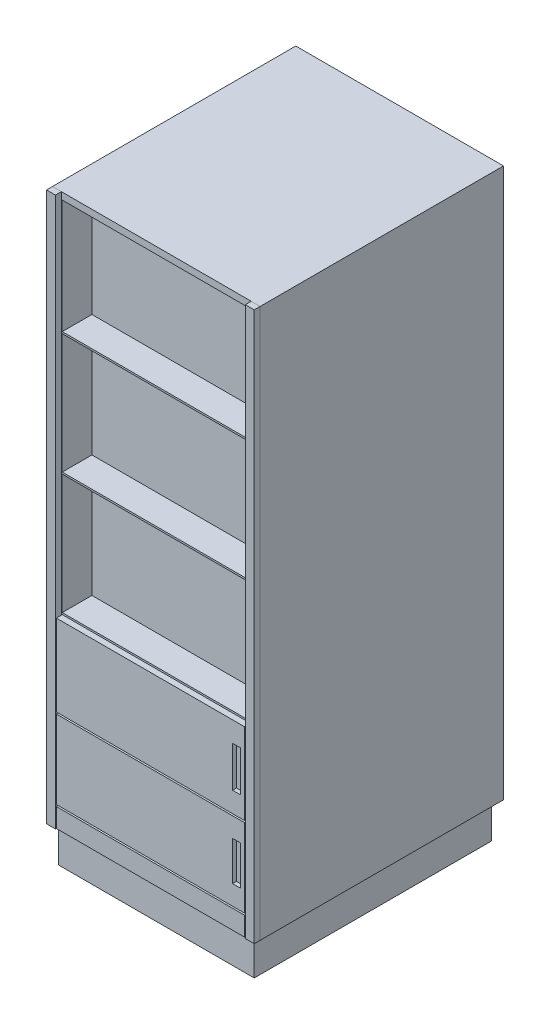
from build123d import *

# Parameters (mm, degrees)
SKETCH1_W              = 700
SKETCH1_H              = 1850
GOVDE_KASA_DEPTH       = 820
SKETCH2_W              = 660
SKETCH2_H              = 120
PLINT_DEPTH            = 800
SKETCH3_W              = 30
SKETCH3_H              = 1850
SOVE_SOL_DEPTH         = 20
SKETCH4_W              = 30
SKETCH4_H              = 1850
SOVE_SAG_DEPTH         = 20
SKETCH5_W              = 634
SKETCH5_H              = 384
ACIKLIK_KAT1_DEPTH     = 100
SKETCH6_W              = 634
SKETCH6_H              = 404
ACIKLIK_KAT2_DEPTH     = 100
SKETCH7_W              = 634
SKETCH7_H              = 404
ACIKLIK_KAT3_DEPTH     = 100
SKETCH8_W              = 634
SKETCH8_H              = 274
KLAPE_ALT_1_DEPTH      = 20
KLAPE_ALT_1_KULP_START = 7
SKETCH9_W              = 26
SKETCH9_H              = 137
KLAPE_ALT_1_KULP_DEPTH = 13
SKETCH10_W             = 634
SKETCH10_H             = 264
KLAPE_ALT_2_DEPTH      = 20
KLAPE_ALT_2_KULP_START = 7
SKETCH11_W             = 26
SKETCH11_H             = 132
KLAPE_ALT_2_KULP_DEPTH = 13
SKETCH12_W             = 634
SKETCH12_H             = 64
PANEL_ALT_DEPTH        = 20


with BuildPart() as part:
    # Sketch1 → govde_kasa (new body)
    with BuildSketch(Plane.XY):
        with Locations((350, 1045)):
            Rectangle(SKETCH1_W, SKETCH1_H)
    extrude(amount=-GOVDE_KASA_DEPTH)

    # Sketch5 → aciklik_kat1 (cut)
    with BuildSketch(Plane.XY):
        with Locations((350, 1755)):
            Rectangle(SKETCH5_W, SKETCH5_H)
    extrude(amount=-ACIKLIK_KAT1_DEPTH, mode=Mode.SUBTRACT)

    # Sketch6 → aciklik_kat2 (cut)
    with BuildSketch(Plane.XY):
        with Locations((350, 1355)):
            Rectangle(SKETCH6_W, SKETCH6_H)
    extrude(amount=-ACIKLIK_KAT2_DEPTH, mode=Mode.SUBTRACT)

    # Sketch7 → aciklik_kat3 (cut)
    with BuildSketch(Plane.XY):
        with Locations((350, 945)):
            Rectangle(SKETCH7_W, SKETCH7_H)
    extrude(amount=-ACIKLIK_KAT3_DEPTH, mode=Mode.SUBTRACT)


with BuildPart() as body_2:
    # Sketch2 → plint (new body)
    with BuildSketch(Plane.XY):
        with Locations((350, 60)):
            Rectangle(SKETCH2_W, SKETCH2_H)
    extrude(amount=-PLINT_DEPTH)


with BuildPart() as body_3:
    # Sketch3 → sove_sol (new body)
    with BuildSketch(Plane.XY):
        with Locations((15, 1045)):
            Rectangle(SKETCH3_W, SKETCH3_H)
    extrude(amount=SOVE_SOL_DEPTH)


with BuildPart() as body_4:
    # Sketch4 → sove_sag (new body)
    with BuildSketch(Plane.XY):
        with Locations((685, 1045)):
            Rectangle(SKETCH4_W, SKETCH4_H)
    extrude(amount=SOVE_SAG_DEPTH)


with BuildPart() as body_5:
    # Sketch8 → klape_alt_1 (new body)
    with BuildSketch(Plane.XY):
        with Locations((350, 600)):
            Rectangle(SKETCH8_W, SKETCH8_H)
    extrude(amount=KLAPE_ALT_1_DEPTH)

    # Sketch9 → klape_alt_1_kulp (cut)
    with BuildSketch(Plane.XY.offset(KLAPE_ALT_1_KULP_START)):
        with Locations((640, 600)):
            Rectangle(SKETCH9_W, SKETCH9_H)
    extrude(amount=KLAPE_ALT_1_KULP_DEPTH, mode=Mode.SUBTRACT)


with BuildPart() as body_6:
    # Sketch10 → klape_alt_2 (new body)
    with BuildSketch(Plane.XY):
        with Locations((350, 325)):
            Rectangle(SKETCH10_W, SKETCH10_H)
    extrude(amount=KLAPE_ALT_2_DEPTH)

    # Sketch11 → klape_alt_2_kulp (cut)
    with BuildSketch(Plane.XY.offset(KLAPE_ALT_2_KULP_START)):
        with Locations((640, 325)):
            Rectangle(SKETCH11_W, SKETCH11_H)
    extrude(amount=KLAPE_ALT_2_KULP_DEPTH, mode=Mode.SUBTRACT)


with BuildPart() as body_7:
    # Sketch12 → panel_alt (new body)
    with BuildSketch(Plane.XY):
        with Locations((350, 155)):
            Rectangle(SKETCH12_W, SKETCH12_H)
    extrude(amount=PANEL_ALT_DEPTH)


solid = Compound([part.part, body_2.part, body_3.part, body_4.part, body_5.part, body_6.part, body_7.part])
